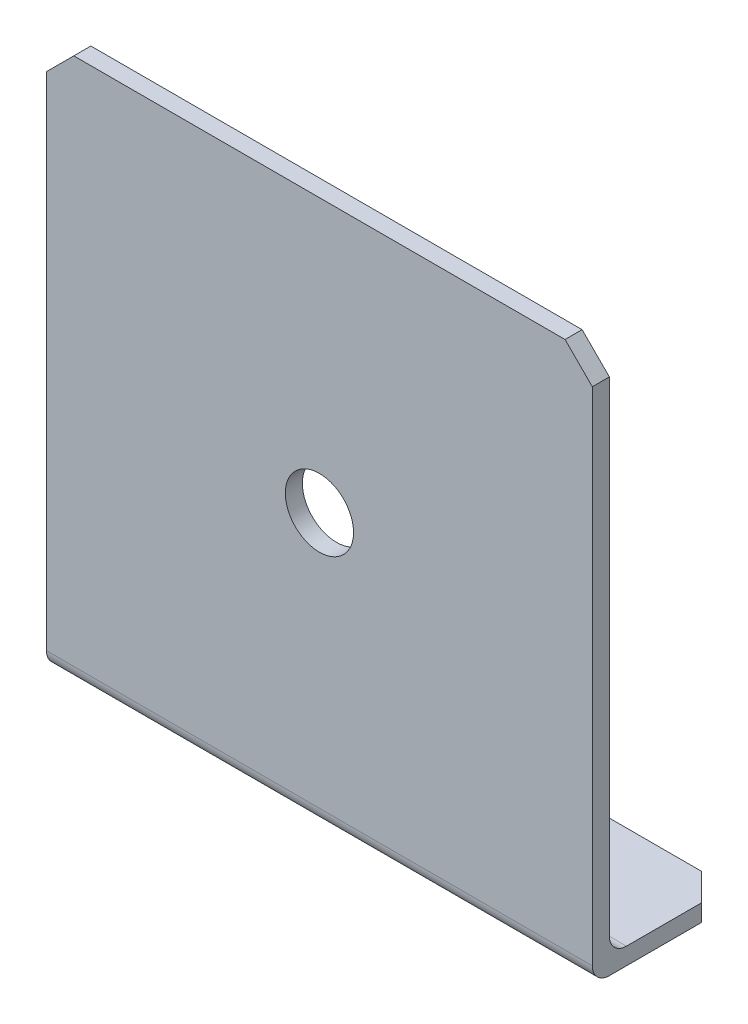
from build123d import *

# Parameters (mm, degrees)
BOSS_EXTRUDE1_DEPTH = 50.8
SKETCH2_R           = 2.54
CUT_EXTRUDE1_DEPTH  = 73.955945611
SKETCH3_R           = 3.175
CUT_EXTRUDE2_DEPTH  = 73.955945611
CHAMFER1_SIZE       = 2.54


with BuildPart() as part:
    # Sketch1 → Boss-Extrude1 (new body)
    with BuildSketch(Plane(origin=(0, 0, 0), x_dir=(0, 0, -1), z_dir=(1, 0, 0))):
        with BuildLine():
            Line((0, 1.5875), (0, 50.8))
            Line((0, 50.8), (1.5875, 50.8))
            Line((1.5875, 50.8), (1.5875, 3.175))
            ThreePointArc((1.5875, 3.175), (2.052467985, 2.052467985), (3.175, 1.5875))
            Line((3.175, 1.5875), (12.7, 1.5875))
            Line((12.7, 1.5875), (12.7, 0))
            Line((12.7, 0), (1.5875, 0))
            ThreePointArc((1.5875, 0), (0.464967985, 0.464967985), (0, 1.5875))
        make_face()
    extrude(amount=BOSS_EXTRUDE1_DEPTH)

    # Sketch2 → Cut-Extrude1 (cut, through all)
    with BuildSketch(Plane.XZ):
        with Locations(Location((38.1, -6.35, 0), (0, 0, 270))):
            Circle(SKETCH2_R)
        with Locations(Location((12.7, -6.35, 0), (0, 0, 270))):
            Circle(SKETCH2_R)
    extrude(amount=-CUT_EXTRUDE1_DEPTH, mode=Mode.SUBTRACT)

    # Sketch3 → Cut-Extrude2 (cut, through all)
    with BuildSketch(Plane.XY):
        with Locations((25.4, 25.4)):
            Circle(SKETCH3_R)
    extrude(amount=-CUT_EXTRUDE2_DEPTH, mode=Mode.SUBTRACT)

    # Chamfer1
    chamfer1_edges = [part.edges().sort_by_distance(p)[0] for p in [
        (0, 50.8, -0.79375),
        (50.8, 0.79375, -12.7),
        (50.8, 50.8, -0.79375),
        (0, 0.79375, -12.7),
    ]]
    chamfer(chamfer1_edges, length=CHAMFER1_SIZE)


solid = part.part
